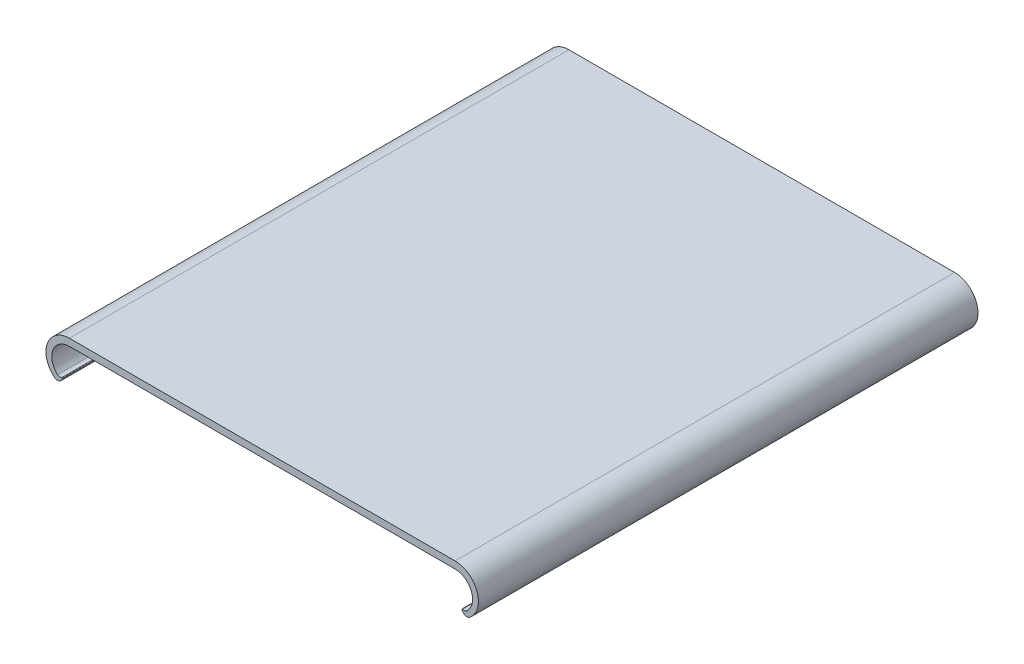
from build123d import *

# Parameters (mm, degrees)
EXTRUDE_1_DEPTH = 42.75


with BuildPart() as part:
    # ｽｹｯﾁ1 → ﾎﾞｽ - 押し出し1 (new, symmetric)
    with BuildSketch(Plane.XY):
        with BuildLine():
            Line((33, 0), (-33, 0))
            ThreePointArc((-33, 0), (-36.75647589, -2.625631458), (-35.581391146, -7.055555556))
            ThreePointArc((-35.581391146, -7.055555556), (-34.748138628, -7.207150732), (-34.197540305, -6.563619582))
            ThreePointArc((-34.197540305, -6.563619582), (-34.230384711, -6.483196795), (-34.317201966, -6.480140047))
            ThreePointArc((-34.317201966, -6.480140047), (-34.687300356, -6.562097055), (-35.032845527, -6.40625))
            ThreePointArc((-35.032845527, -6.40625), (-35.794525899, -3.108842358), (-33, -1.2))
            Line((-33, -1.2), (33, -1.2))
            ThreePointArc((33, -1.2), (35.794525899, -3.108842358), (35.032845527, -6.40625))
            ThreePointArc((35.032845527, -6.40625), (34.687300356, -6.562097055), (34.317201966, -6.480140047))
            ThreePointArc((34.317201966, -6.480140047), (34.230384711, -6.483196795), (34.197540305, -6.563619582))
            ThreePointArc((34.197540305, -6.563619582), (34.748138628, -7.207150732), (35.581391146, -7.055555556))
            ThreePointArc((35.581391146, -7.055555556), (36.75647589, -2.625631458), (33, 0))
        make_face()
    extrude(amount=EXTRUDE_1_DEPTH, both=True)


solid = part.part
